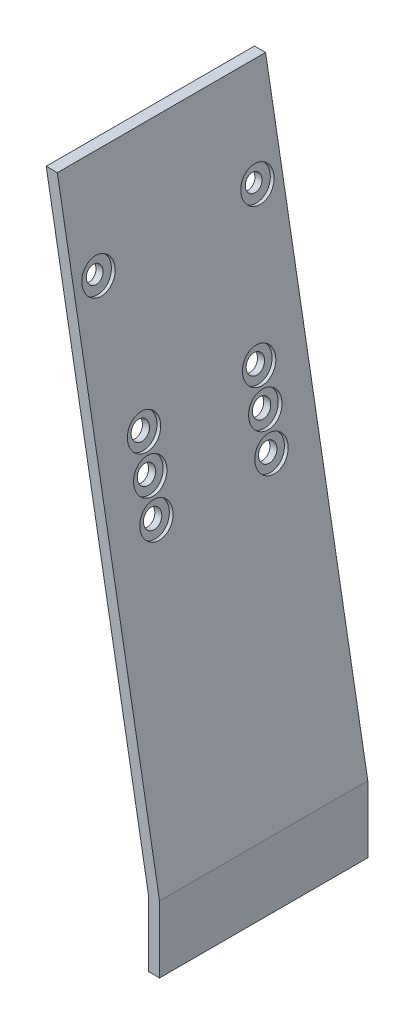
from build123d import *

# Parameters (mm, degrees)
EXTRUDE_1_DEPTH     = 39
SKETCH_7_R          = 1.65
CUT_EXTRUDE_1_DEPTH = 10
SKETCH_11_R         = 1.5
CUT_EXTRUDE_2_DEPTH = 10
SKETCH_12_W         = 29.009042243
SKETCH_12_H         = 10
CUT_EXTRUDE_3_DEPTH = 40
SKETCH_14_R         = 3
CUT_EXTRUDE_4_DEPTH = 0.7
SKETCH_17_W         = 22.396032982
SKETCH_17_H         = 19.376343142
CUT_EXTRUDE_5_DEPTH = 48
SKETCH_18_W         = 48.955276493
SKETCH_18_H         = 0.5
SKETCH_18_W_2       = 40.156862745
CUT_EXTRUDE_6_DEPTH = 150


with BuildPart() as part:
    # 草图1 → 凸台-拉伸1 (new body)
    with BuildSketch(Plane.XY):
        Polygon((18.538024786, -87.708726548), (18.538024786, -75.708726548), (-3.150193841, 47.291273452), (-1.119340617, 47.291273452), (20.538024786, -75.533749221), (20.538024786, -87.708726548), align=None)
    extrude(amount=EXTRUDE_1_DEPTH)

    # 草图7 → 切除-拉伸1 (cut)
    with BuildSketch(Plane(origin=(7.001695694, 1.234587862, 0), x_dir=(0, 0, -1), z_dir=(0.9848077530122079, 0.17364817766693164, 0))):
        with Locations(Location((-30, -19.232815796, 0), (0, 0, 90))):
            Circle(SKETCH_7_R)
        with Locations(Location((-9, -19.232815796, 0), (0, 0, 90))):
            Circle(SKETCH_7_R)
        with Locations(Location((-30, -12.732815796, 0), (0, 0, 90))):
            Circle(SKETCH_7_R)
        with Locations(Location((-9, -12.732815796, 0), (0, 0, 90))):
            Circle(SKETCH_7_R)
        with Locations(Location((-9, -25.732815796, 0), (0, 0, 90))):
            Circle(SKETCH_7_R)
        with Locations(Location((-30, -25.732815796, 0), (0, 0, 90))):
            Circle(SKETCH_7_R)
    extrude(amount=-CUT_EXTRUDE_1_DEPTH, mode=Mode.SUBTRACT)

    # 草图11 → 切除-拉伸2 (cut)
    with BuildSketch(Plane(origin=(5.032080188, 0.887291506, 0), x_dir=(0, 0, 1), z_dir=(-0.9848077530122079, -0.1736481776669316, 0))):
        with Locations(Location((5, 12.119838165, 0), (0, 0, 270))):
            Circle(SKETCH_11_R)
        with Locations(Location((34, 12.119838165, 0), (0, 0, 270))):
            Circle(SKETCH_11_R)
    extrude(amount=-CUT_EXTRUDE_2_DEPTH, mode=Mode.SUBTRACT)

    # 草图12 → 切除-拉伸3 (cut)
    with BuildSketch(Plane.XY.offset(39)):
        with Locations((0.338832517, 47.079233545)):
            Rectangle(SKETCH_12_W, SKETCH_12_H)
    extrude(amount=-CUT_EXTRUDE_3_DEPTH, mode=Mode.SUBTRACT)

    # 草图14 → 切除-拉伸4 (cut)
    with BuildSketch(Plane(origin=(7.001695694, 1.234587862, 0), x_dir=(0, 0, -1), z_dir=(0.9848077530122078, 0.17364817766693164, 0))):
        with Locations(Location((-34, 12.119838165, 0), (0, 0, 90))):
            Circle(SKETCH_14_R)
        with Locations(Location((-5, 12.119838165, 0), (0, 0, 90))):
            Circle(SKETCH_14_R)
        with Locations(Location((-30, -19.232815796, 0), (0, 0, 90))):
            Circle(SKETCH_14_R)
        with Locations(Location((-9, -19.232815796, 0), (0, 0, 90))):
            Circle(SKETCH_14_R)
        with Locations(Location((-30, -12.732815796, 0), (0, 0, 90))):
            Circle(SKETCH_14_R)
        with Locations(Location((-9, -12.732815796, 0), (0, 0, 90))):
            Circle(SKETCH_14_R)
        with Locations(Location((-30, -25.732815796, 0), (0, 0, 90))):
            Circle(SKETCH_14_R)
        with Locations(Location((-9, -25.732815796, 0), (0, 0, 90))):
            Circle(SKETCH_14_R)
    extrude(amount=-CUT_EXTRUDE_4_DEPTH, mode=Mode.SUBTRACT)

    # 草图17 → 切除-拉伸5 (cut)
    with BuildSketch(Plane(origin=(0, 0, 0), x_dir=(-1, 0, 0), z_dir=(0, 0, -1))):
        with Locations((2.347013145, 39.90800246)):
            Rectangle(SKETCH_17_W, SKETCH_17_H)
    extrude(amount=-CUT_EXTRUDE_5_DEPTH, mode=Mode.SUBTRACT)

    # 草图18 → 切除-拉伸6 (cut)
    with BuildSketch(Plane(origin=(0, 30.219830889, 0), x_dir=(1, 0, 0), z_dir=(0, 1, 0))):
        with Locations((4.107783916, -0.25)):
            Rectangle(SKETCH_18_W, SKETCH_18_H)
        with Locations((8.50699079, -38.75)):
            Rectangle(SKETCH_18_W_2, SKETCH_18_H)
    extrude(amount=-CUT_EXTRUDE_6_DEPTH, mode=Mode.SUBTRACT)


solid = part.part
